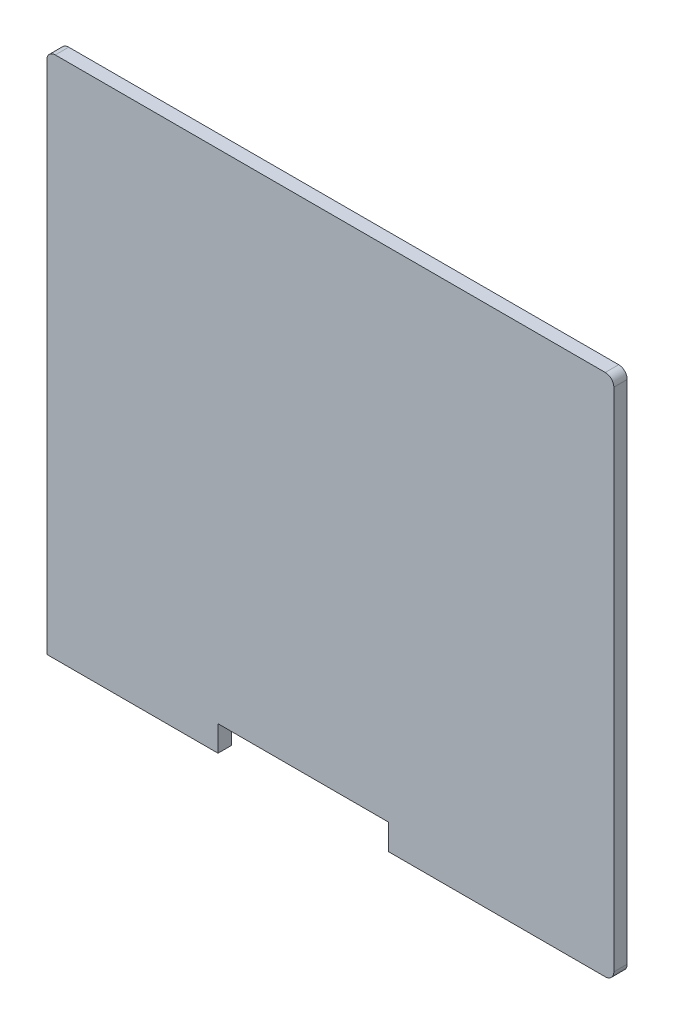
from build123d import *

# Parameters (mm, degrees)
BOSS_EXTRUDE1_DEPTH = 1.5748


with BuildPart() as part:
    # BPR2 PCB Outline → Boss-Extrude1 (new body)
    with BuildSketch(Plane.XY):
        with BuildLine():
            Line((75.642984325, 7.317563979), (75.642984325, 10.317563979))
            Line((75.642984325, 10.317563979), (95.642984325, 10.317563979))
            Line((95.642984325, 10.317563979), (95.642984325, 7.317563979))
            Line((95.642984325, 7.317563979), (121.040984325, 7.317563979))
            ThreePointArc((121.040984325, 7.317563979), (121.748091106, 7.610457198), (122.040984325, 8.317563979))
            Line((122.040984325, 8.317563979), (122.040984325, 67.672563979))
            ThreePointArc((122.040984325, 67.672563979), (121.748091106, 68.37967076), (121.040984325, 68.672563979))
            Line((121.040984325, 68.672563979), (56.570984325, 68.672563979))
            ThreePointArc((56.570984325, 68.672563979), (55.863877543, 68.37967076), (55.570984325, 67.672563979))
            Line((55.570984325, 67.672563979), (55.570984325, 7.317563979))
            Line((55.570984325, 7.317563979), (75.642984325, 7.317563979))
        make_face()
    extrude(amount=-BOSS_EXTRUDE1_DEPTH)


solid = part.part
